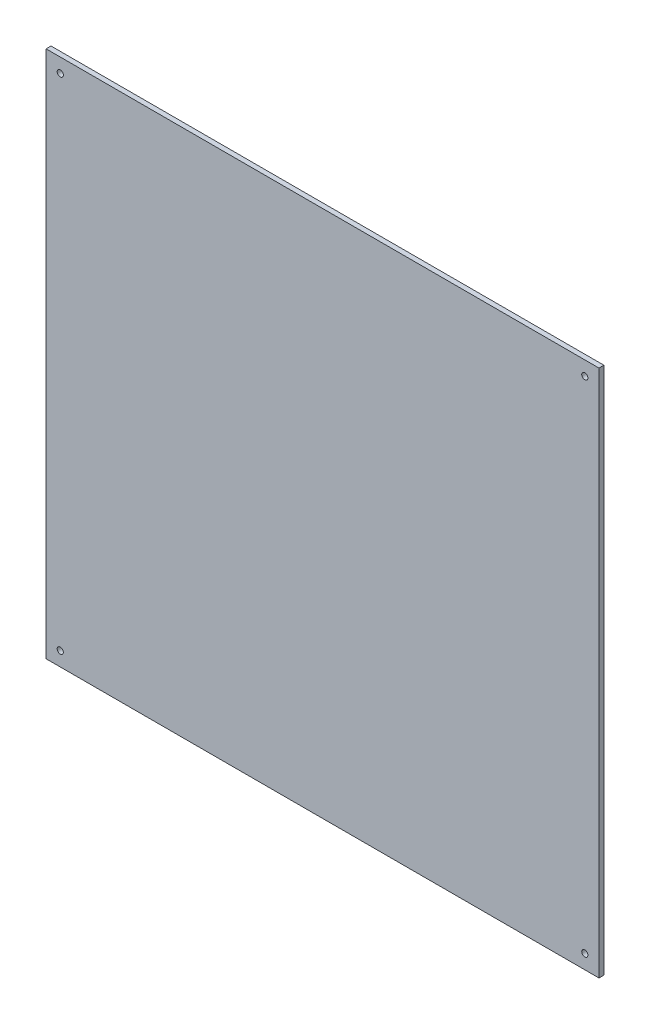
from build123d import *

# Parameters (mm, degrees)
SCHIZZO1_W                   = 449
SCHIZZO1_H                   = 429
SCHIZZO1_R                   = 2.5
ESTRUSIONE_ESTRUSIONE1_DEPTH = 4


with BuildPart() as part:
    # Schizzo1 → Estrusione-Estrusione1 (new body)
    with BuildSketch(Plane.XY):
        with Locations((-224.5, 214.5)):
            Rectangle(SCHIZZO1_W, SCHIZZO1_H)
        with Locations((-437.5, 417.5)):
            Circle(SCHIZZO1_R, mode=Mode.SUBTRACT)
        with Locations(Location((-11.5, 417.5, 0), (0, 0, 180))):
            Circle(SCHIZZO1_R, mode=Mode.SUBTRACT)
        with Locations(Location((-437.5, 11.5, 0), (0, 0, 180))):
            Circle(SCHIZZO1_R, mode=Mode.SUBTRACT)
        with Locations((-11.5, 11.5)):
            Circle(SCHIZZO1_R, mode=Mode.SUBTRACT)
    extrude(amount=ESTRUSIONE_ESTRUSIONE1_DEPTH)


solid = part.part
